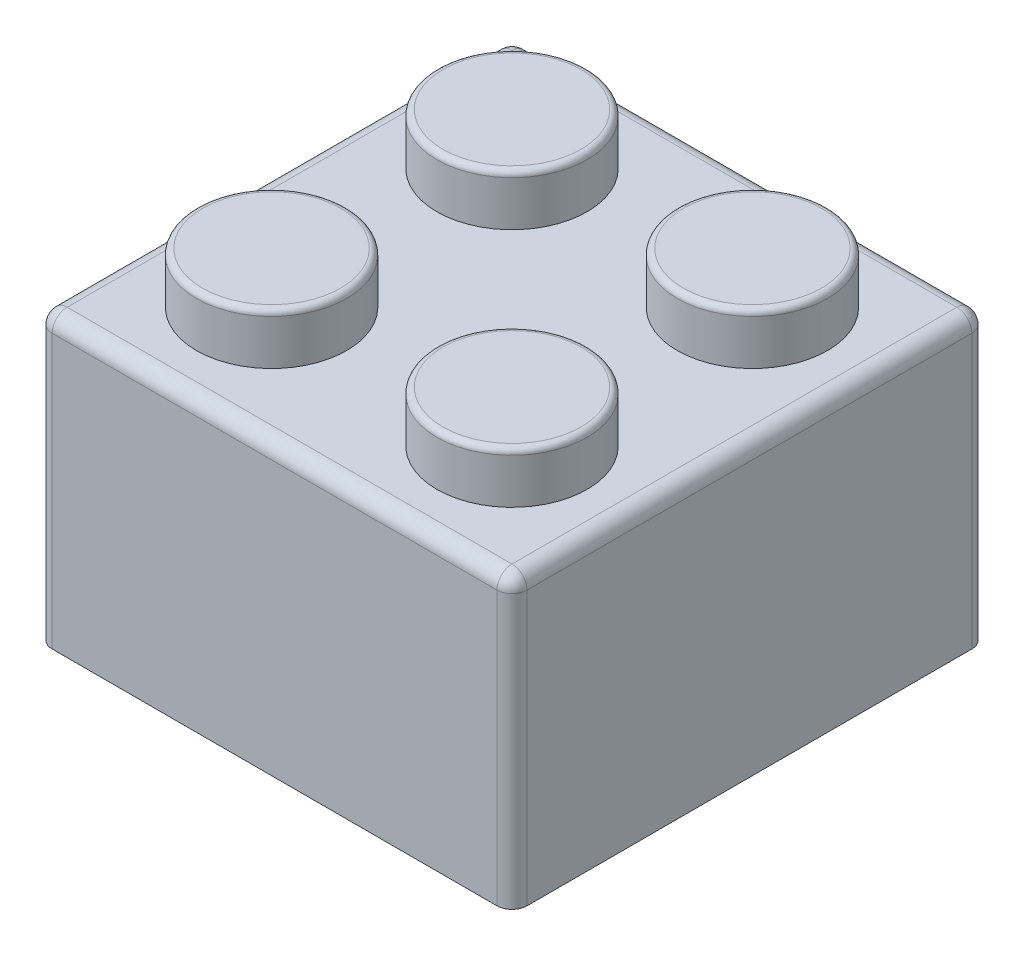
from build123d import *

# Parameters (mm, degrees)
SKETCH1_W              = 15.8
SKETCH1_H              = 15.8
BOSS_EXTRUDE1_DEPTH    = 9.6
FILLET1_R              = 0.5
SKETCH2_W              = 12.82
SKETCH2_H              = 12.82
CUT_EXTRUDE1_DEPTH     = 8.1
SKETCH3_R              = 2.5
BOSS_EXTRUDE2_DEPTH    = 1.7
FILLET2_R              = 0.2
LPATTERN1_COUNT        = 2
LPATTERN1_PITCH        = 8
LPATTERN1_COUNT_DIR2   = 2
LPATTERN1_PITCH_DIR2   = 8
FILLET2_OF_LPATTERN1_R = 0.2
SKETCH4_R              = 3.155
BOSS_EXTRUDE3_DEPTH    = 8.1
SKETCH5_R              = 2.655
CUT_EXTRUDE2_DEPTH     = 8.1


with BuildPart() as part:
    # Sketch1 → Boss-Extrude1 (new body)
    with BuildSketch(Plane(origin=(0, 0, 0), x_dir=(1, 0, 0), z_dir=(0, 1, 0))):
        with Locations((0.374568966, -1.328017241)):
            Rectangle(SKETCH1_W, SKETCH1_H)
    extrude(amount=BOSS_EXTRUDE1_DEPTH)

    # Fillet1
    fillet1_edges = [part.edges().sort_by_distance(p)[0] for p in [
        (8.274568966, 9.6, 1.328017241),
        (0.374568966, 9.6, -6.571982759),
        (-7.525431034, 9.6, 1.328017241),
        (0.374568966, 9.6, 9.228017241),
        (-7.525431034, 4.8, -6.571982759),
        (8.274568966, 4.8, -6.571982759),
        (8.274568966, 4.8, 9.228017241),
        (-7.525431034, 4.8, 9.228017241),
    ]]
    fillet(fillet1_edges, radius=FILLET1_R)

    # Sketch2 → Cut-Extrude1 (cut)
    with BuildSketch(Plane.XZ):
        with Locations((0.374568966, 1.328017241)):
            Rectangle(SKETCH2_W, SKETCH2_H)
    extrude(amount=-CUT_EXTRUDE1_DEPTH, mode=Mode.SUBTRACT)

    # Sketch3 → Boss-Extrude2 (add)
    with BuildSketch(Plane(origin=(0, 9.6, 0), x_dir=(1, 0, 0), z_dir=(0, 1, 0))):
        with Locations(Location((-3.625431034, 2.671982759, 0), (0, 0, 270))):
            Circle(SKETCH3_R)
    boss_extrude2 = extrude(amount=BOSS_EXTRUDE2_DEPTH)

    # Fillet2
    fillet2_edges = [part.edges().sort_by_distance(p)[0] for p in [
        (-3.625431034, 11.3, -5.171982759),
    ]]
    fillet(fillet2_edges, radius=FILLET2_R)

    # LPattern1: Boss-Extrude2 2 × 2
    with Locations(*[(i * LPATTERN1_PITCH, 0, j * LPATTERN1_PITCH_DIR2) for i in range(LPATTERN1_COUNT) for j in range(LPATTERN1_COUNT_DIR2) if (i, j) != (0, 0)]):
        add(boss_extrude2)

    # Fillet2 of LPattern1
    fillet2_of_lpattern1_edges = [part.edges().sort_by_distance(p)[0] for p in [
        (-3.625431034, 11.3, 2.828017241),
        (4.374568966, 11.3, -5.171982759),
        (4.374568966, 11.3, 2.828017241),
    ]]
    fillet(fillet2_of_lpattern1_edges, radius=FILLET2_OF_LPATTERN1_R)

    # Sketch4 → Boss-Extrude3 (add)
    with BuildSketch(Plane.XZ.offset(-8.1)):
        with Locations(Location((0.374568966, 1.328017241, 0), (0, 0, 90))):
            Circle(SKETCH4_R)
    extrude(amount=BOSS_EXTRUDE3_DEPTH)

    # Sketch5 → Cut-Extrude2 (cut)
    with BuildSketch(Plane.XZ):
        with Locations(Location((0.374568966, 1.328017241, 0), (0, 0, 270))):
            Circle(SKETCH5_R)
    extrude(amount=-CUT_EXTRUDE2_DEPTH, mode=Mode.SUBTRACT)


solid = part.part
